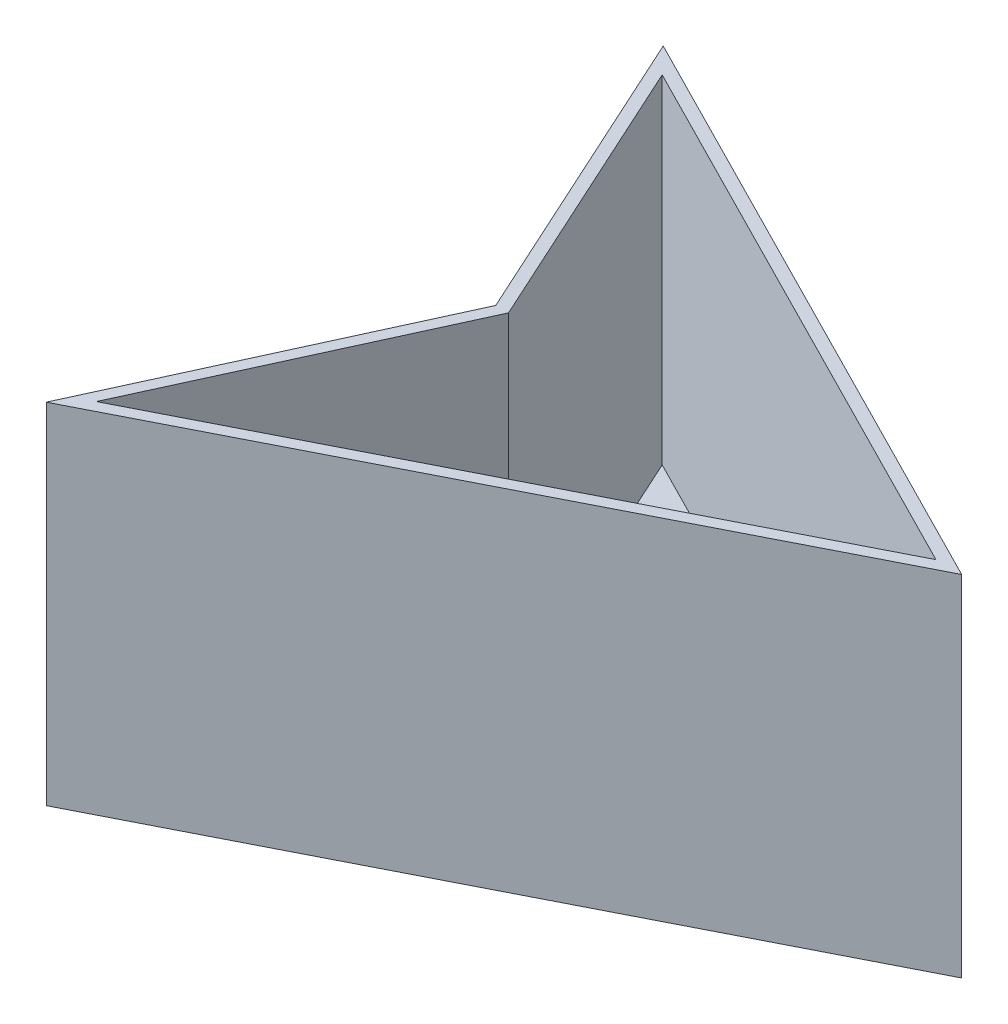
from build123d import *

# Parameters (mm, degrees)
SALIENTE_EXTRUIR1_DEPTH = 15
VACIADO1_T              = -0.5


with BuildPart() as part:
    # Croquis2 → Saliente-Extruir1 (new body)
    with BuildSketch(Plane(origin=(0, 0, 0), x_dir=(1, 0, 0), z_dir=(0, 1, 0))):
        Polygon((20, 0), (-6.05, 13.239344826), (0, 0), (-6.05, -13.239344826), align=None)
    extrude(amount=SALIENTE_EXTRUIR1_DEPTH)

    # Vaciado1
    vaciado1_openings = [part.faces().sort_by_distance(p)[0] for p in [
        (4.65, 15, 0),
    ]]
    offset(amount=VACIADO1_T, openings=vaciado1_openings, kind=Kind.INTERSECTION)


solid = part.part
